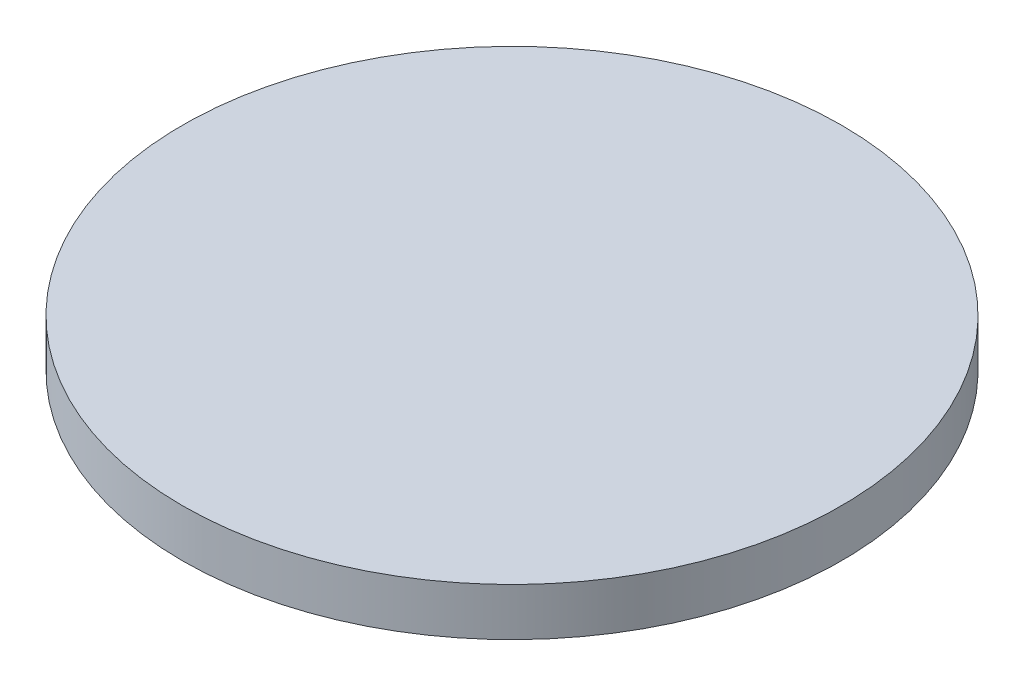
from build123d import *

# Parameters (mm, degrees)
SKETCH1_R           = 6.9
BOSS_EXTRUDE1_DEPTH = 1


with BuildPart() as part:
    # Sketch1 → Boss-Extrude1 (new body)
    with BuildSketch(Plane(origin=(0, 0, 0), x_dir=(1, 0, 0), z_dir=(0, 1, 0))):
        with Locations(Location((0, 0, 0), (0, 0, 270))):
            Circle(SKETCH1_R)
    extrude(amount=BOSS_EXTRUDE1_DEPTH)


solid = part.part
